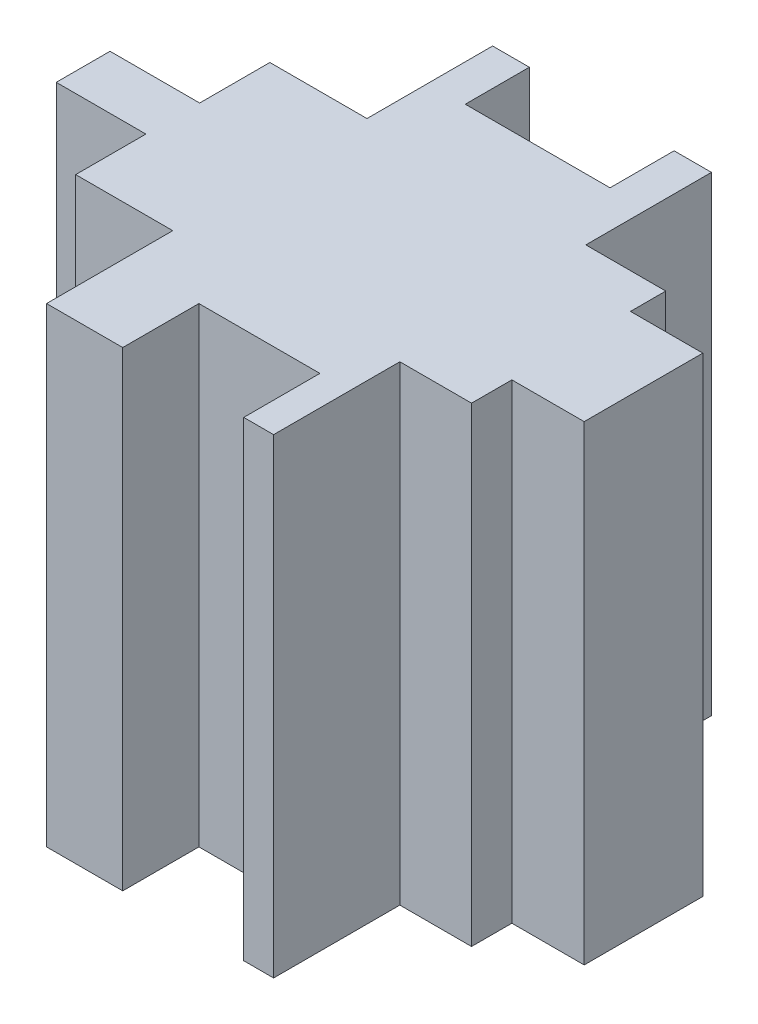
from build123d import *

# Parameters (mm, degrees)
BOSS_EXTRUDE1_DEPTH = 800.1


with BuildPart() as part:
    # Sketch1 → Boss-Extrude1 (new body)
    with BuildSketch(Plane(origin=(0, 0, 0), x_dir=(1, 0, 0), z_dir=(0, 1, 0))):
        Polygon((537.21, 330.2), (673.1, 330.2), (673.1, 270.256), (796.036, 270.256), (796.036, 68.58), (673.1, 68.58), (673.1, 0), (551.18, 0), (551.18, -85.09), (551.18, -214.63), (500.38, -214.63), (500.38, -85.09), (294.64, -85.09), (294.64, -214.63), (165.1, -214.63), (165.1, -85.09), (165.1, 0), (0, 0), (0, 119.38), (-152.4, 119.38), (-152.4, 210.82), (0, 210.82), (0, 330.2), (165.1, 330.2), (165.1, 434.848), (165.1, 543.814), (227.584, 543.814), (227.584, 434.848), (473.71, 434.848), (473.71, 543.814), (537.21, 543.814), (537.21, 434.848), align=None)
    extrude(amount=BOSS_EXTRUDE1_DEPTH)


solid = part.part
